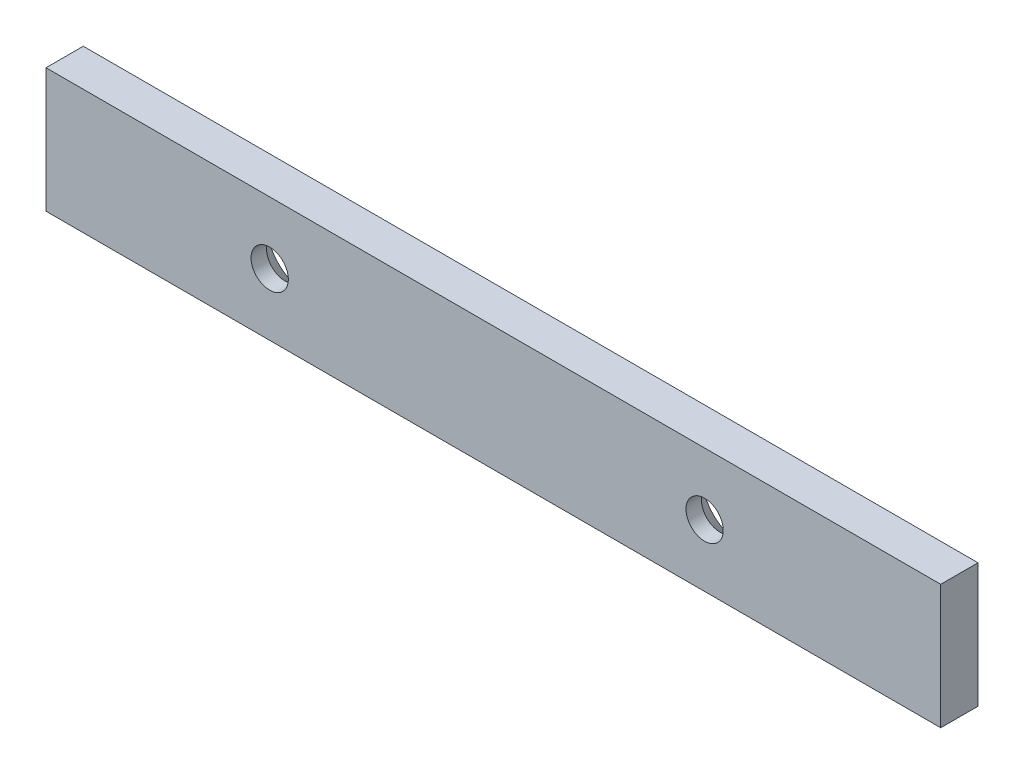
from build123d import *

# Parameters (mm, degrees)
SKETCH1_W                                           = 144
SKETCH1_H                                           = 20
BOSS_EXTRUDE1_DEPTH                                 = 6
CSK_FOR_M6_COUNTERSUNK_FLAT_HEAD_SCREW1_D           = 6
CSK_FOR_M6_COUNTERSUNK_FLAT_HEAD_SCREW1_DEPTH       = 17.5
CSK_FOR_M6_COUNTERSUNK_FLAT_HEAD_SCREW1_CSINK_D     = 13
CSK_FOR_M6_COUNTERSUNK_FLAT_HEAD_SCREW1_CSINK_ANGLE = 90
CSK_FOR_M6_COUNTERSUNK_FLAT_HEAD_SCREW1_TIP         = 1.802581857


with BuildPart() as part:
    # Sketch1 → Boss-Extrude1 (new body)
    with BuildSketch(Plane.XY):
        with Locations((16.335821826, 4.315981806)):
            Rectangle(SKETCH1_W, SKETCH1_H)
    extrude(amount=BOSS_EXTRUDE1_DEPTH)

    # CSK for M6 Countersunk Flat Head Screw1
    with Locations(Plane(origin=(0, 0, 0), x_dir=(-1, 0, 0), z_dir=(0, 0, -1))):
        with Locations((-50.335821826, 4.315981806), (19.664178174, 4.315981806)):
            CounterSinkHole(CSK_FOR_M6_COUNTERSUNK_FLAT_HEAD_SCREW1_D / 2, CSK_FOR_M6_COUNTERSUNK_FLAT_HEAD_SCREW1_CSINK_D / 2, depth=CSK_FOR_M6_COUNTERSUNK_FLAT_HEAD_SCREW1_DEPTH, counter_sink_angle=CSK_FOR_M6_COUNTERSUNK_FLAT_HEAD_SCREW1_CSINK_ANGLE)
            with Locations((0, 0, -(CSK_FOR_M6_COUNTERSUNK_FLAT_HEAD_SCREW1_DEPTH + CSK_FOR_M6_COUNTERSUNK_FLAT_HEAD_SCREW1_TIP / 2))):  # 118° drill point
                Cone(0, CSK_FOR_M6_COUNTERSUNK_FLAT_HEAD_SCREW1_D / 2, CSK_FOR_M6_COUNTERSUNK_FLAT_HEAD_SCREW1_TIP, mode=Mode.SUBTRACT)


solid = part.part
